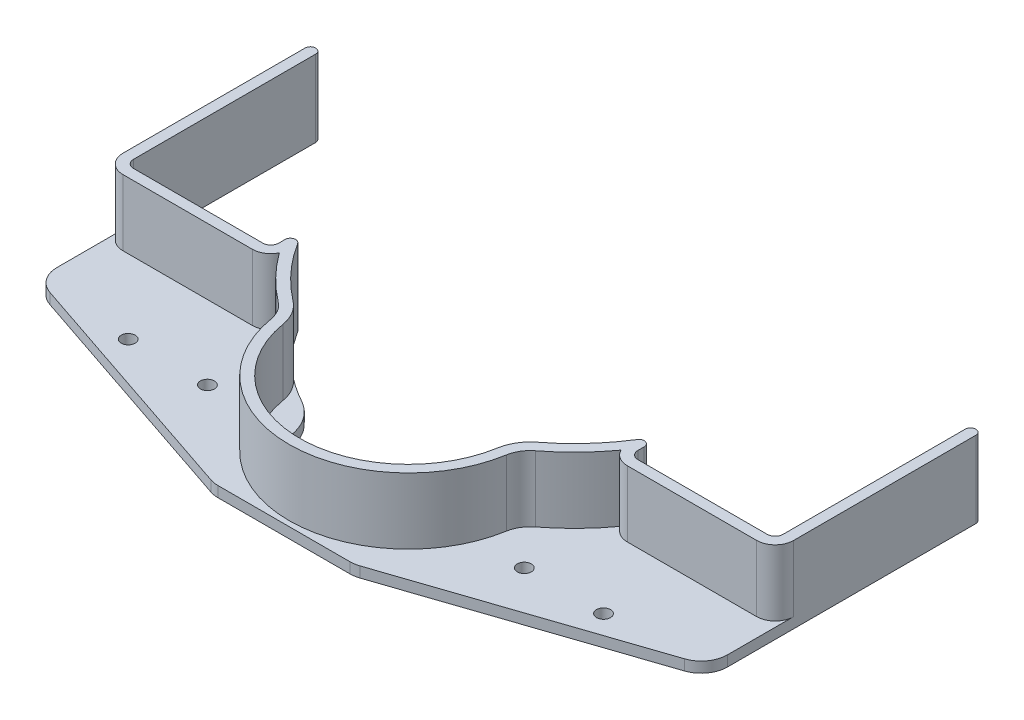
from build123d import *

# Parameters (mm, degrees)
SKETCH_2_R      = 2.65
EXTRUDE_1_DEPTH = 4
EXTRUDE_2_DEPTH = 25


with BuildPart() as part:
    # 草图2 → 凸台-拉伸1 (new body)
    # profile 1 of 5: a face of its own
    with BuildSketch(Plane(origin=(0, 0, 0), x_dir=(1, 0, 0), z_dir=(0, 1, 0))):
        with BuildLine():
            Line((-27.5, 2), (-27.5, 12.147710197))
            ThreePointArc((-27.5, 12.147710197), (-29.994681763, 21.290199266), (-36.787234043, 27.898510474))
            ThreePointArc((-36.787234043, 27.898510474), (-38.913878838, 29.12011529), (-41, 30.409702399))
            ThreePointArc((-41, 30.409702399), (-53.947743005, 40.870206984), (-64.307692308, 53.898547461))
            ThreePointArc((-64.307692308, 53.898547461), (-66.554700196, 54.754207886), (-68, 52.832670041))
            Line((-68, 52.832670041), (-68, 50.409702399))
            ThreePointArc((-68, 50.409702399), (-68.878679656, 48.288382056), (-71, 47.409702399))
            Line((-71, 47.409702399), (-120, 47.409702399))
            ThreePointArc((-120, 47.409702399), (-122.121320344, 48.288382056), (-123, 50.409702399))
            Line((-123, 50.409702399), (-123, 119.409702399))
            ThreePointArc((-123, 119.409702399), (-125, 121.409702399), (-127, 119.409702399))
            Line((-127, 119.409702399), (-127, 25.409702399))
            ThreePointArc((-127, 25.409702399), (-125.121934023, 19.575819668), (-120.193162456, 15.933220271))
            Line((-120.193162456, 15.933220271), (-90, 5.759437269))
            Line((-90, 5.759437269), (-90, 12.759702399))
            ThreePointArc((-90, 12.759702399), (-91.87383297, 17.283535369), (-87.35, 15.409702399))
            Line((-87.35, 15.409702399), (-62.65, 15.409702399))
            ThreePointArc((-62.65, 15.409702399), (-60, 18.059702399), (-57.35, 15.409702399))
            ThreePointArc((-57.35, 15.409702399), (-58.12616703, 13.535869429), (-60, 12.759702399))
            Line((-60, 12.759702399), (-60, -4.349258383))
            Line((-60, -4.349258383), (-28.193162456, -15.066779729))
            ThreePointArc((-28.193162456, -15.066779729), (-26.617896585, -15.458550265), (-25, -15.590297601))
            Line((-25, -15.590297601), (25, -15.590297601))
            ThreePointArc((25, -15.590297601), (26.617896585, -15.458550265), (28.193162456, -15.066779729))
            Line((28.193162456, -15.066779729), (120.193162456, 15.933220271))
            ThreePointArc((120.193162456, 15.933220271), (125.121934023, 19.575819668), (127, 25.409702399))
            Line((127, 25.409702399), (127, 119.409702399))
            ThreePointArc((127, 119.409702399), (125, 121.409702399), (123, 119.409702399))
            Line((123, 119.409702399), (123, 50.409702399))
            ThreePointArc((123, 50.409702399), (122.121320344, 48.288382056), (120, 47.409702399))
            Line((120, 47.409702399), (71, 47.409702399))
            ThreePointArc((71, 47.409702399), (68.878679656, 48.288382056), (68, 50.409702399))
            Line((68, 50.409702399), (68, 52.832670041))
            ThreePointArc((68, 52.832670041), (66.554700196, 54.754207886), (64.307692308, 53.898547461))
            ThreePointArc((64.307692308, 53.898547461), (52.192399009, 39.157401138), (36.787234043, 27.898510474))
            ThreePointArc((36.787234043, 27.898510474), (29.994681763, 21.290199266), (27.5, 12.147710197))
            Line((27.5, 12.147710197), (27.5, 2))
            ThreePointArc((27.5, 2), (26.914213562, 0.585786438), (25.5, 0))
            Line((25.5, 0), (-25.5, 0))
            ThreePointArc((-25.5, 0), (-26.914213562, 0.585786438), (-27.5, 2))
        make_face()
        with Locations(Location((60, 15.409702399, 0), (0, 0, 270))):
            Circle(SKETCH_2_R, mode=Mode.SUBTRACT)
        with Locations(Location((90, 15.409702399, 0), (0, 0, 270))):
            Circle(SKETCH_2_R, mode=Mode.SUBTRACT)
    # profile 2 of 5: a face of its own
    with BuildSketch(Plane(origin=(0, 0, 0), x_dir=(1, 0, 0), z_dir=(0, 1, 0))):
        with BuildLine():
            Line((-90, 12.759702399), (-90, 5.759437269))
            Line((-90, 5.759437269), (-77.378818279, 1.506647776))
            Line((-77.378818279, 1.506647776), (-75, 3.409702399))
            Line((-75, 3.409702399), (-87.930697655, 13.754260523))
            ThreePointArc((-87.930697655, 13.754260523), (-88.852049864, 13.021248823), (-90, 12.759702399))
        make_face()
    # profile 3 of 5: a face of its own
    with BuildSketch(Plane(origin=(0, 0, 0), x_dir=(1, 0, 0), z_dir=(0, 1, 0))):
        with BuildLine():
            Line((-87.930697655, 13.754260523), (-75, 3.409702399))
            Line((-75, 3.409702399), (-62.069302345, 13.754260523))
            ThreePointArc((-62.069302345, 13.754260523), (-62.500615046, 14.532534004), (-62.65, 15.409702399))
            Line((-62.65, 15.409702399), (-87.35, 15.409702399))
            ThreePointArc((-87.35, 15.409702399), (-87.499384954, 14.532534004), (-87.930697655, 13.754260523))
        make_face()
    # profile 4 of 5: a face of its own
    with BuildSketch(Plane(origin=(0, 0, 0), x_dir=(1, 0, 0), z_dir=(0, 1, 0))):
        with BuildLine():
            Line((-75, 3.409702399), (-69.159051832, -1.263056135))
            Line((-69.159051832, -1.263056135), (-60, -4.349258383))
            Line((-60, -4.349258383), (-60, 12.759702399))
            ThreePointArc((-60, 12.759702399), (-61.147950136, 13.021248823), (-62.069302345, 13.754260523))
            Line((-62.069302345, 13.754260523), (-75, 3.409702399))
        make_face()
    # profile 5 of 5: a face of its own
    with BuildSketch(Plane(origin=(0, 0, 0), x_dir=(1, 0, 0), z_dir=(0, 1, 0))):
        Polygon((-75, 3.409702399), (-77.378818279, 1.506647776), (-69.159051832, -1.263056135), align=None)
    extrude(amount=EXTRUDE_1_DEPTH)

    # 草图3 → 凸台-拉伸2 (add)
    with BuildSketch(Plane(origin=(0, 4, 0), x_dir=(1, 0, 0), z_dir=(0, 1, 0))):
        with BuildLine():
            Line((127, 50.409702399), (127, 115.409702399))
            Line((127, 115.409702399), (127, 119.409702399))
            ThreePointArc((127, 119.409702399), (125, 121.409702399), (123, 119.409702399))
            Line((123, 119.409702399), (123, 50.409702399))
            ThreePointArc((123, 50.409702399), (122.121320344, 48.288382056), (120, 47.409702399))
            Line((120, 47.409702399), (71, 47.409702399))
            ThreePointArc((71, 47.409702399), (68.878679656, 48.288382056), (68, 50.409702399))
            Line((68, 50.409702399), (68, 52.832670041))
            ThreePointArc((68, 52.832670041), (66.554700196, 54.754207886), (64.307692308, 53.898547461))
            ThreePointArc((64.307692308, 53.898547461), (56.167018952, 43.203588844), (46.269641343, 34.109930672))
            ThreePointArc((46.269641343, 34.109930672), (42.548019366, 29.9419633), (40.610070261, 24.701087856))
            ThreePointArc((40.610070261, 24.701087856), (0, -9.642140289), (-40.610070261, 24.701087856))
            ThreePointArc((-40.610070261, 24.701087856), (-42.548019366, 29.9419633), (-46.269641343, 34.109930672))
            ThreePointArc((-46.269641343, 34.109930672), (-56.167018952, 43.203588844), (-64.307692308, 53.898547461))
            ThreePointArc((-64.307692308, 53.898547461), (-66.554700196, 54.754207886), (-68, 52.832670041))
            Line((-68, 52.832670041), (-68, 50.409702399))
            ThreePointArc((-68, 50.409702399), (-68.878679656, 48.288382056), (-71, 47.409702399))
            Line((-71, 47.409702399), (-120, 47.409702399))
            ThreePointArc((-120, 47.409702399), (-122.121320344, 48.288382056), (-123, 50.409702399))
            Line((-123, 50.409702399), (-123, 119.409702399))
            ThreePointArc((-123, 119.409702399), (-125, 121.409702399), (-127, 119.409702399))
            Line((-127, 119.409702399), (-127, 115.409702399))
            Line((-127, 115.409702399), (-127, 50.409702399))
            ThreePointArc((-127, 50.409702399), (-124.949747468, 45.459954931), (-120, 43.409702399))
            Line((-120, 43.409702399), (-71, 43.409702399))
            ThreePointArc((-71, 43.409702399), (-67.284863149, 44.476932542), (-64.702556592, 47.353200063))
            ThreePointArc((-64.702556592, 47.353200063), (-57.294743258, 38.568992354), (-48.704885624, 30.936669685))
            ThreePointArc((-48.704885624, 30.936669685), (-45.975696175, 27.880160279), (-44.554533498, 24.03685162))
            ThreePointArc((-44.554533498, 24.03685162), (0, -13.642140289), (44.554533498, 24.03685162))
            ThreePointArc((44.554533498, 24.03685162), (45.975696175, 27.880160279), (48.704885624, 30.936669685))
            ThreePointArc((48.704885624, 30.936669685), (57.294743258, 38.568992354), (64.702556592, 47.353200063))
            ThreePointArc((64.702556592, 47.353200063), (67.284863149, 44.476932542), (71, 43.409702399))
            Line((71, 43.409702399), (120, 43.409702399))
            ThreePointArc((120, 43.409702399), (124.949747468, 45.459954931), (127, 50.409702399))
        make_face()
    extrude(amount=EXTRUDE_2_DEPTH)


solid = part.part
